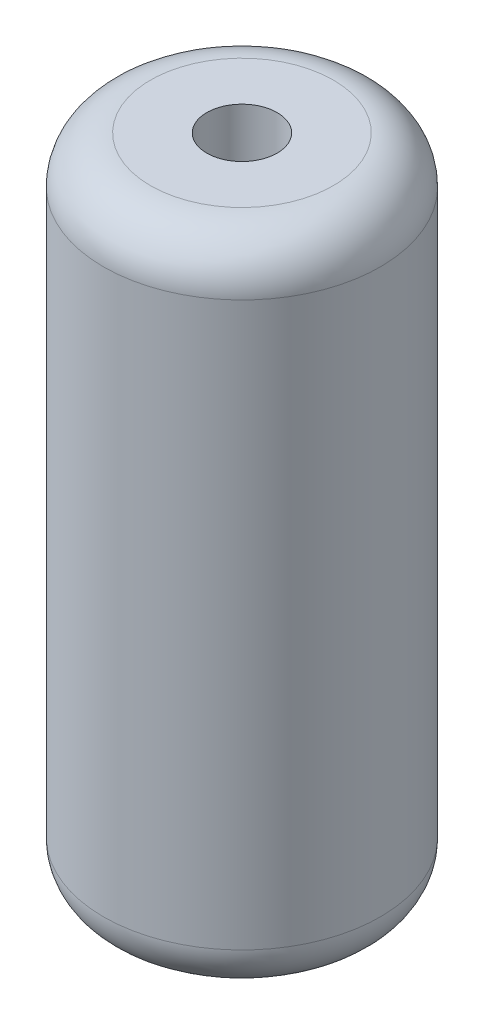
from build123d import *

# Parameters (mm, degrees)
SKETCH1_R           = 29.5
BOSS_EXTRUDE1_DEPTH = 70
FILLET1_R           = 10
SKETCH2_R           = 7.5
CUT_EXTRUDE1_DEPTH  = 147.083880034


with BuildPart() as part:
    # Sketch1 → Boss-Extrude1 (new, symmetric)
    with BuildSketch(Plane(origin=(0, 0, 0), x_dir=(1, 0, 0), z_dir=(0, 1, 0))):
        with Locations(Location((0, 0, 0), (0, 0, 270))):
            Circle(SKETCH1_R)
    extrude(amount=BOSS_EXTRUDE1_DEPTH, both=True)

    # Fillet1
    fillet1_edges = [part.edges().sort_by_distance(p)[0] for p in [
        (0, -70, -29.5),
        (0, 70, -29.5),
    ]]
    fillet(fillet1_edges, radius=FILLET1_R)

    # Sketch2 → Cut-Extrude1 (cut, through all)
    with BuildSketch(Plane(origin=(0, 70, 0), x_dir=(1, 0, 0), z_dir=(0, 1, 0))):
        with Locations(Location((0, 0, 0), (0, 0, 270))):
            Circle(SKETCH2_R)
    extrude(amount=-CUT_EXTRUDE1_DEPTH, mode=Mode.SUBTRACT)


solid = part.part
